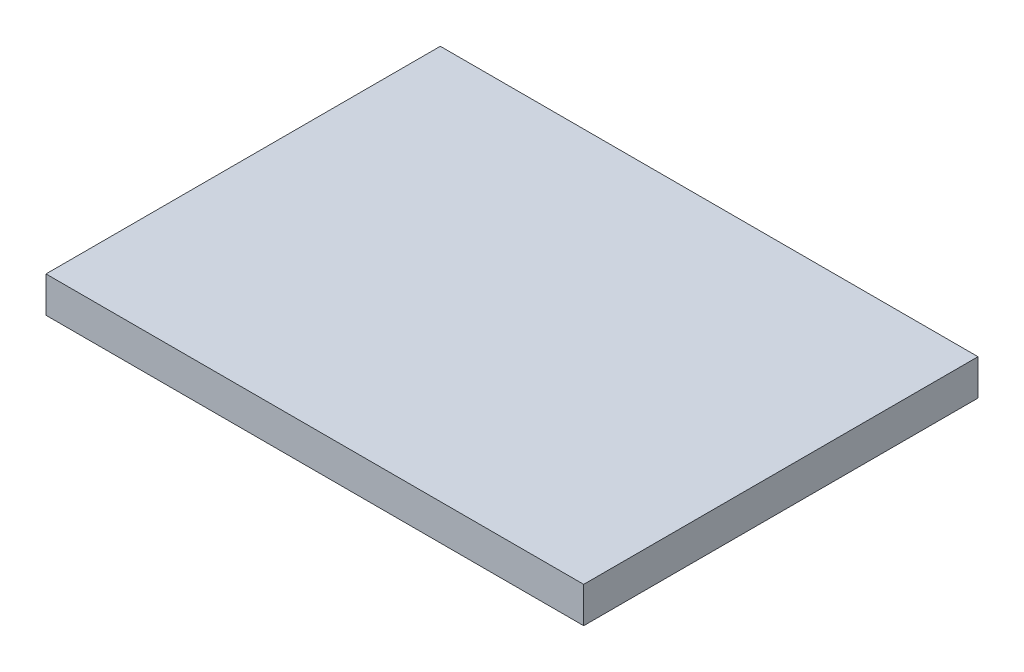
from build123d import *

# Parameters (mm, degrees)
SKETCH1_W           = 15
SKETCH1_H           = 11
BOSS_EXTRUDE1_DEPTH = 1


with BuildPart() as part:
    # Sketch1 → Boss-Extrude1 (new body)
    with BuildSketch(Plane(origin=(0, 0, 0), x_dir=(1, 0, 0), z_dir=(0, 1, 0))):
        Rectangle(SKETCH1_W, SKETCH1_H)
    extrude(amount=BOSS_EXTRUDE1_DEPTH)


solid = part.part
